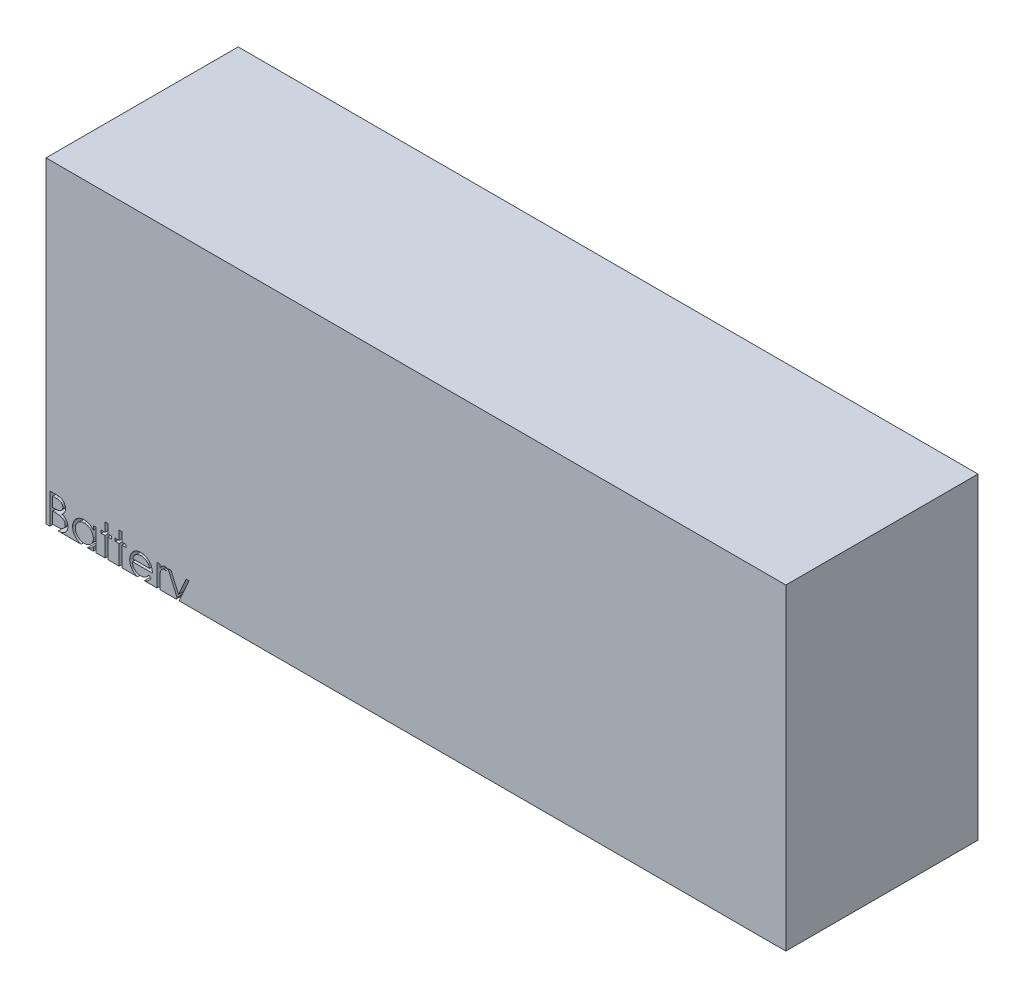
from build123d import *

# Parameters (mm, degrees)
SKETCH1_W           = 77
SKETCH1_H           = 20
BOSS_EXTRUDE1_DEPTH = 33
CUT_EXTRUDE1_DEPTH  = 1.27


with BuildPart() as part:
    # Sketch1 → Boss-Extrude1 (new body)
    with BuildSketch(Plane(origin=(0, 0, 0), x_dir=(1, 0, 0), z_dir=(0, 1, 0))):
        with Locations((38.5, 10)):
            Rectangle(SKETCH1_W, SKETCH1_H)
    extrude(amount=BOSS_EXTRUDE1_DEPTH)

    # Sketch2 → Cut-Extrude1 (cut)
    # profile 1 of 7: a face of its own
    with BuildSketch(Plane.XY):
        with BuildLine():
            Line((0.407051282, 3.175), (1.026532452, 3.175))
            add(Edge.make_bspline(
                [(1.026532452, 3.175), (1.056856857, 3.174840569), (1.115633102, 3.174531553), (1.201103595, 3.169738998), (1.281157873, 3.163204241), (1.355819153, 3.152835514), (1.425052933, 3.140324401), (1.489067861, 3.125173468), (1.547660374, 3.107006469), (1.617612642, 3.078117342), (1.697369242, 3.035188468), (1.783727784, 2.97175327), (1.857573058, 2.894163107), (1.921242074, 2.806639555), (1.971861661, 2.710359248), (2.008482381, 2.607616984), (2.031667025, 2.499737975), (2.03405139, 2.425675949), (2.03525641, 2.388246194)],
                knots=[0, 0, 0, 0, 1.001505555, 1.941167018, 2.826882275, 3.653841531, 4.429895133, 5.150066043, 5.825578002, 6.45369114, 7.647487171, 8.808567382, 9.977351308, 11.170798116, 12.373658725, 13.556498008, 14.765093433, 16, 16, 16, 16], degree=3))
            add(Edge.make_bspline(
                [(2.03525641, 2.388246194), (2.034264705, 2.353182804), (2.032315911, 2.284279937), (2.013680693, 2.183501709), (1.984506372, 2.087570246), (1.943952325, 1.996835654), (1.891245514, 1.913348019), (1.828781182, 1.836433856), (1.753418654, 1.769349683), (1.696955144, 1.731845764), (1.668274239, 1.712795473)],
                knots=[0, 0, 0, 0, 1.044552857, 2.05264487, 3.044412934, 4.028983338, 5.005914585, 5.980388656, 6.974128949, 8, 8, 8, 8], degree=3))
            add(Edge.make_bspline(
                [(1.668274239, 1.712795473), (1.704342627, 1.698947938), (1.773350388, 1.672454174), (1.868315556, 1.625613431), (1.950135165, 1.574666374), (2.019438291, 1.519029624), (2.078708878, 1.459059489), (2.130464046, 1.393876635), (2.174625007, 1.322630762), (2.212464588, 1.246064698), (2.241990959, 1.164960259), (2.264103387, 1.080078197), (2.276773858, 0.991722887), (2.278576933, 0.931592578), (2.279487179, 0.901236979)],
                knots=[0, 0, 0, 0, 1.27268992, 2.434971085, 3.483601985, 4.442670788, 5.356604649, 6.2567628, 7.179492994, 8.113709626, 9.066344395, 10.018646069, 10.999752585, 12, 12, 12, 12], degree=3))
            add(Edge.make_bspline(
                [(2.279487179, 0.901236979), (2.278601041, 0.870242745), (2.276857537, 0.809260721), (2.263994277, 0.719675707), (2.242214587, 0.634064148), (2.212214333, 0.551872304), (2.173059948, 0.473259182), (2.12540958, 0.398135721), (2.068593805, 0.327256721), (2.005036774, 0.259834577), (1.933134684, 0.199212227), (1.855559678, 0.145222979), (1.771334802, 0.100821908), (1.681843351, 0.063523803), (1.586081435, 0.035032987), (1.48447907, 0.015100724), (1.377123882, 0.00167044), (1.303455036, 0.000566261), (1.26567508, 0)],
                knots=[0, 0, 0, 0, 0.978564426, 1.925352924, 2.850884081, 3.763762016, 4.682927383, 5.618979971, 6.567305752, 7.547517671, 8.540179244, 9.531824382, 10.526200242, 11.540722885, 12.589160233, 13.674978461, 14.80764778, 16, 16, 16, 16], degree=3))
            Line((1.26567508, 0), (0.407051282, 0))
            Line((0.407051282, 0), (0.407051282, 3.175))
        make_face()
        with BuildLine():
            Line((0.691987179, 2.849358974), (0.691987179, 1.831730769))
            Line((0.691987179, 1.831730769), (0.883428486, 1.831730769))
            add(Edge.make_bspline(
                [(0.883428486, 1.831730769), (0.91141275, 1.832093557), (0.965484052, 1.832794536), (1.043788529, 1.834802512), (1.116473367, 1.840425023), (1.183413101, 1.846045917), (1.244502318, 1.855185008), (1.299605678, 1.866063576), (1.349587977, 1.877568783), (1.407227422, 1.897135389), (1.472607882, 1.926052994), (1.542306484, 1.970931017), (1.603751324, 2.024383823), (1.655637345, 2.086061339), (1.698102036, 2.153975664), (1.72759662, 2.227043192), (1.747596657, 2.303442883), (1.74940326, 2.355892298), (1.750320513, 2.382522035)],
                knots=[0, 0, 0, 0, 1.156816544, 2.235205308, 3.236616184, 4.169592532, 5.011045266, 5.787822928, 6.49130361, 7.128639758, 8.301311294, 9.436451833, 10.541879658, 11.654887649, 12.756523258, 13.837046038, 14.901820046, 16, 16, 16, 16], degree=3))
            add(Edge.make_bspline(
                [(1.750320513, 2.382522035), (1.749843192, 2.400143985), (1.748906876, 2.434711364), (1.741238523, 2.485102564), (1.72820508, 2.532495111), (1.7114644, 2.577538482), (1.688070375, 2.618824232), (1.660526376, 2.657779845), (1.627247214, 2.693078696), (1.589367366, 2.726071026), (1.545816687, 2.755321419), (1.496621158, 2.780939826), (1.441115194, 2.801568959), (1.380234247, 2.819635755), (1.313041189, 2.832325136), (1.240311416, 2.842896423), (1.161449206, 2.848278267), (1.106889006, 2.848990704), (1.078685897, 2.849358974)],
                knots=[0, 0, 0, 0, 0.91205012, 1.789085906, 2.630437955, 3.453916878, 4.269457761, 5.079663411, 5.91843418, 6.774407191, 7.675494373, 8.627863946, 9.638891023, 10.736472738, 11.911756761, 13.175263542, 14.539845004, 16, 16, 16, 16], degree=3))
            Line((1.078685897, 2.849358974), (0.691987179, 2.849358974))
        make_face(mode=Mode.SUBTRACT)
        with BuildLine():
            Line((0.691987179, 1.506089744), (0.691987179, 0.325641026))
            Line((0.691987179, 0.325641026), (1.097766426, 0.325641026))
            add(Edge.make_bspline(
                [(1.097766426, 0.325641026), (1.126812166, 0.325989139), (1.182794001, 0.326660083), (1.263621545, 0.328850429), (1.338536218, 0.333832707), (1.40719617, 0.341675728), (1.470342795, 0.350183321), (1.527218568, 0.361623555), (1.578284536, 0.374730826), (1.637497658, 0.394991111), (1.704175841, 0.426465766), (1.776031403, 0.473922243), (1.839918044, 0.530458387), (1.894169958, 0.59589143), (1.93863174, 0.667039848), (1.970976332, 0.742464559), (1.99092518, 0.820919287), (1.993340148, 0.874410519), (1.994551282, 0.901236979)],
                knots=[0, 0, 0, 0, 1.160039823, 2.235823828, 3.228722157, 4.157150951, 4.99529583, 5.772374946, 6.472645482, 7.099169577, 8.269452708, 9.405989375, 10.527446681, 11.663510218, 12.788923519, 13.866172445, 14.929861265, 16, 16, 16, 16], degree=3))
            add(Edge.make_bspline(
                [(1.994551282, 0.901236979), (1.994300816, 0.918013081), (1.993803924, 0.951294684), (1.986310366, 1.000204035), (1.97541207, 1.047580363), (1.961322841, 1.093552313), (1.940803753, 1.137288733), (1.916849244, 1.179654626), (1.88876283, 1.220705997), (1.844998479, 1.272605684), (1.781342465, 1.332401831), (1.690894175, 1.390946565), (1.588049305, 1.438161362), (1.513457222, 1.458208744), (1.47492488, 1.468564704)],
                knots=[0, 0, 0, 0, 0.723448775, 1.435228256, 2.130040452, 2.821711965, 3.505591119, 4.210454504, 4.921174351, 5.648778258, 7.137944449, 8.670945889, 10.280296675, 12, 12, 12, 12], degree=3))
            add(Edge.make_bspline(
                [(1.47492488, 1.468564704), (1.459477057, 1.471698958), (1.425982991, 1.478494669), (1.371366115, 1.485668086), (1.309012862, 1.492058961), (1.238779252, 1.496786226), (1.160576425, 1.50167259), (1.074237363, 1.503572892), (0.980114656, 1.505840078), (0.91480729, 1.506004393), (0.880884415, 1.506089744)],
                knots=[0, 0, 0, 0, 0.634451884, 1.375622551, 2.216452059, 3.157844607, 4.20941857, 5.370758133, 6.634282058, 8, 8, 8, 8], degree=3))
            Line((0.880884415, 1.506089744), (0.691987179, 1.506089744))
        make_face(mode=Mode.SUBTRACT)
    # profile 2 of 7: a face of its own
    with BuildSketch(Plane.XY):
        with BuildLine():
            Line((5.21025641, 2.320192308), (5.21025641, 0))
            Line((5.21025641, 0), (4.925320513, 0))
            Line((4.925320513, 0), (4.925320513, 0.401327123))
            add(Edge.make_bspline(
                [(4.925320513, 0.401327123), (4.89319061, 0.365005492), (4.8304887, 0.294123371), (4.725767115, 0.201520257), (4.614761696, 0.124977066), (4.498011212, 0.063155356), (4.375621091, 0.016716848), (4.247862641, -0.016290596), (4.114683745, -0.037512147), (4.023740538, -0.039631252), (3.977654247, -0.040705128)],
                knots=[0, 0, 0, 0, 1.074387032, 2.096679803, 3.090159297, 4.057316773, 5.018401886, 5.985159533, 6.978961417, 8, 8, 8, 8], degree=3))
            add(Edge.make_bspline(
                [(3.977654247, -0.040705128), (3.93668046, -0.039592633), (3.855878339, -0.037398744), (3.737016247, -0.020378655), (3.622632564, 0.006954124), (3.512619201, 0.044964216), (3.407688041, 0.095383962), (3.306940667, 0.155746379), (3.210899011, 0.227629132), (3.121026972, 0.309805415), (3.038266515, 0.399063725), (2.965639503, 0.494264328), (2.905084924, 0.594995561), (2.854448136, 0.699982065), (2.815444309, 0.810032028), (2.788253941, 0.924764887), (2.771253679, 1.044044987), (2.769060697, 1.125270126), (2.767948718, 1.16645633)],
                knots=[0, 0, 0, 0, 1.033919861, 2.038935746, 3.024066025, 3.998881131, 4.97069526, 5.957263378, 6.95902576, 7.993208707, 9.027059324, 10.027763471, 11.009749337, 11.988697705, 12.965288445, 13.950418724, 14.960734635, 16, 16, 16, 16], degree=3))
            add(Edge.make_bspline(
                [(2.767948718, 1.16645633), (2.769085342, 1.206791261), (2.771332386, 1.286531244), (2.788072093, 1.403805492), (2.816221651, 1.516761342), (2.85572577, 1.625035141), (2.9063824, 1.728757901), (2.968002879, 1.82800298), (3.040591657, 1.923043791), (3.124277769, 2.011645547), (3.214932882, 2.093488533), (3.311914373, 2.164616738), (3.412809779, 2.226045594), (3.519184081, 2.274716962), (3.629462812, 2.314095221), (3.744627723, 2.341339413), (3.864199655, 2.357393412), (3.945380316, 2.359718205), (3.986558494, 2.360897436)],
                knots=[0, 0, 0, 0, 1.020392517, 2.01726096, 2.990465484, 3.961182959, 4.928053699, 5.906110375, 6.912531644, 7.948652711, 8.985773172, 9.998621852, 10.987621588, 11.969261332, 12.953316658, 13.946091881, 14.958173133, 16, 16, 16, 16], degree=3))
            add(Edge.make_bspline(
                [(3.986558494, 2.360897436), (4.033911223, 2.35959319), (4.12676769, 2.357035625), (4.262592384, 2.335751579), (4.391084161, 2.299793827), (4.513234894, 2.250882954), (4.628605945, 2.185887321), (4.736105081, 2.103899785), (4.836857341, 2.005437423), (4.895259463, 1.929808519), (4.925320513, 1.890880409)],
                knots=[0, 0, 0, 0, 1.038897134, 2.037228247, 3.008116434, 3.962042015, 4.918381754, 5.904844433, 6.921570401, 8, 8, 8, 8], degree=3))
            Line((4.925320513, 1.890880409), (4.925320513, 2.320192308))
            Line((4.925320513, 2.320192308), (5.21025641, 2.320192308))
        make_face()
        with BuildLine():
            add(Edge.make_bspline(
                [(3.990374599, 2.075961538), (3.948723736, 2.074479596), (3.866511556, 2.071554476), (3.74582164, 2.04871852), (3.630330185, 2.010723209), (3.520614818, 1.958760342), (3.41840865, 1.893419988), (3.327065106, 1.814388447), (3.245837084, 1.723822013), (3.17752173, 1.622129384), (3.121831779, 1.513110687), (3.082673114, 1.399151376), (3.05684744, 1.28230686), (3.054208996, 1.203056424), (3.052884615, 1.163276242)],
                knots=[0, 0, 0, 0, 1.031046209, 2.035121221, 3.029706178, 4.034933723, 5.034054252, 6.02443088, 7.017295772, 8.038157696, 9.050218397, 10.03989886, 11.016116709, 12, 12, 12, 12], degree=3))
            add(Edge.make_bspline(
                [(3.052884615, 1.163276242), (3.05457634, 1.123733788), (3.057953158, 1.044803872), (3.08221986, 0.927800063), (3.122932316, 0.813813896), (3.178487616, 0.703812852), (3.24805334, 0.60168299), (3.328688046, 0.509390164), (3.421171516, 0.430024609), (3.523612897, 0.363587667), (3.633021556, 0.309918809), (3.748078051, 0.272575693), (3.866619523, 0.248465849), (3.947221283, 0.245649645), (3.987830529, 0.244230769)],
                knots=[0, 0, 0, 0, 0.979072187, 1.954306742, 2.945804271, 3.96968567, 4.997920485, 5.998718438, 6.996577872, 8.005894225, 9.015743152, 10.005417472, 10.995077863, 12, 12, 12, 12], degree=3))
            add(Edge.make_bspline(
                [(3.987830529, 0.244230769), (4.029056999, 0.245736594), (4.11105236, 0.248731529), (4.232100331, 0.271665248), (4.349570761, 0.309555515), (4.461863461, 0.362078295), (4.566471666, 0.427172467), (4.660359026, 0.5033789), (4.739748512, 0.592009646), (4.807051808, 0.689415428), (4.859825221, 0.796197025), (4.898266361, 0.909893041), (4.920993832, 1.030507434), (4.923858344, 1.112933996), (4.925320513, 1.155008013)],
                knots=[0, 0, 0, 0, 1.01762866, 2.023962475, 3.030623092, 4.058876274, 5.077231937, 6.066672613, 7.034107872, 8.005628644, 8.981990164, 9.965428785, 10.961468474, 12, 12, 12, 12], degree=3))
            add(Edge.make_bspline(
                [(4.925320513, 1.155008013), (4.924449967, 1.187064473), (4.922736459, 1.250161732), (4.90964587, 1.34280598), (4.888822473, 1.431464432), (4.859479876, 1.5162303), (4.820934211, 1.596634921), (4.774445166, 1.673255618), (4.719195222, 1.745693888), (4.656073776, 1.812952245), (4.586981057, 1.874299107), (4.513870295, 1.929058097), (4.435875289, 1.974042198), (4.354307691, 2.011272494), (4.269025981, 2.040899009), (4.179336204, 2.06066356), (4.086191695, 2.074234708), (4.022649916, 2.075379868), (3.990374599, 2.075961538)],
                knots=[0, 0, 0, 0, 1.050140795, 2.067009409, 3.05949893, 4.030605086, 5.00011959, 5.97591094, 6.962425594, 7.979863591, 8.993523472, 9.986985069, 10.967611495, 11.937549037, 12.921786183, 13.919465291, 14.943216303, 16, 16, 16, 16], degree=3))
        make_face(mode=Mode.SUBTRACT)
    # profile 3 of 7: a face of its own
    with BuildSketch(Plane.XY):
        Polygon((6.146474359, 3.256410256), (6.431410256, 3.256410256), (6.431410256, 2.320192308), (6.838461538, 2.320192308), (6.838461538, 2.03525641), (6.431410256, 2.03525641), (6.431410256, 0), (6.146474359, 0), (6.146474359, 2.03525641), (5.739423077, 2.03525641), (5.739423077, 2.320192308), (6.146474359, 2.320192308), align=None)
    # profile 4 of 7: a face of its own
    with BuildSketch(Plane.XY):
        Polygon((7.611858974, 3.256410256), (7.896794872, 3.256410256), (7.896794872, 2.320192308), (8.303846154, 2.320192308), (8.303846154, 2.03525641), (7.896794872, 2.03525641), (7.896794872, 0), (7.611858974, 0), (7.611858974, 2.03525641), (7.204807692, 2.03525641), (7.204807692, 2.320192308), (7.611858974, 2.320192308), align=None)
    # profile 5 of 7: a face of its own
    with BuildSketch(Plane.XY):
        with BuildLine():
            Line((10.696544471, 0.732692308), (10.949679487, 0.599764623))
            add(Edge.make_bspline(
                [(10.949679487, 0.599764623), (10.929507719, 0.563983887), (10.890261445, 0.494368744), (10.822769338, 0.398726985), (10.752019387, 0.312686557), (10.67481793, 0.238546085), (10.593474721, 0.1739109), (10.50753867, 0.117361587), (10.416562385, 0.069175501), (10.320541564, 0.028578565), (10.218669828, -0.002635762), (10.11070031, -0.024683162), (9.996426167, -0.038311413), (9.918097847, -0.039894505), (9.877989784, -0.040705128)],
                knots=[0, 0, 0, 0, 1.120438281, 2.179929193, 3.190490725, 4.156257408, 5.095198341, 6.022838206, 6.959905092, 7.901321166, 8.864066838, 9.862729781, 10.905609505, 12, 12, 12, 12], degree=3))
            add(Edge.make_bspline(
                [(9.877989784, -0.040705128), (9.83341099, -0.039664476), (9.746450677, -0.037634466), (9.619868193, -0.020133445), (9.500688292, 0.008416481), (9.388917675, 0.048299508), (9.28483006, 0.100394295), (9.18821857, 0.163857539), (9.098575143, 0.238363227), (9.018724611, 0.324556715), (8.946839089, 0.416796776), (8.88340638, 0.5129139), (8.830377139, 0.612666254), (8.787240129, 0.7154188), (8.75240143, 0.820523904), (8.728120206, 0.928937878), (8.71412322, 1.040367301), (8.71197833, 1.115748455), (8.710897436, 1.153735978)],
                knots=[0, 0, 0, 0, 1.145258523, 2.234067595, 3.276747158, 4.290159414, 5.277019952, 6.260822364, 7.254936242, 8.264827045, 9.274100331, 10.257902744, 11.220704747, 12.172965371, 13.118907548, 14.062713208, 15.023725156, 16, 16, 16, 16], degree=3))
            add(Edge.make_bspline(
                [(8.710897436, 1.153735978), (8.711858228, 1.189382002), (8.713762392, 1.260027716), (8.725764607, 1.364590031), (8.747035558, 1.466215842), (8.776224081, 1.564989591), (8.813916997, 1.660745898), (8.860029081, 1.753543042), (8.914632167, 1.843282276), (8.956789521, 1.899890833), (8.97802484, 1.928405449)],
                knots=[0, 0, 0, 0, 1.024358464, 2.0301432, 3.019427413, 4.004406732, 4.986367066, 5.972626655, 6.978780325, 8, 8, 8, 8], degree=3))
            add(Edge.make_bspline(
                [(8.97802484, 1.928405449), (9.006788238, 1.962757924), (9.063403882, 2.030374674), (9.159158576, 2.119218727), (9.262845183, 2.193644152), (9.373164301, 2.25533634), (9.491398102, 2.302211719), (9.615957245, 2.337143598), (9.748260026, 2.356717936), (9.838706905, 2.359482757), (9.884985978, 2.360897436)],
                knots=[0, 0, 0, 0, 1.030682036, 2.02871468, 2.997146059, 3.962720338, 4.930598197, 5.918074684, 6.934738563, 8, 8, 8, 8], degree=3))
            add(Edge.make_bspline(
                [(9.884985978, 2.360897436), (9.932563448, 2.35966912), (10.0258996, 2.357259445), (10.162000167, 2.334919842), (10.290778817, 2.299493596), (10.412184017, 2.249461229), (10.526228076, 2.18490935), (10.632169707, 2.104952108), (10.731820722, 2.012044272), (10.789794933, 1.940594789), (10.819295873, 1.904236779)],
                knots=[0, 0, 0, 0, 1.056321875, 2.072262726, 3.055038591, 4.01806755, 4.982017516, 5.957941055, 6.960871419, 8, 8, 8, 8], degree=3))
            add(Edge.make_bspline(
                [(10.819295873, 1.904236779), (10.839368167, 1.876837816), (10.879379148, 1.822222265), (10.92949616, 1.733167001), (10.973000369, 1.639993819), (11.007773841, 1.541196621), (11.035931102, 1.437946002), (11.056302645, 1.329503836), (11.068249371, 1.215902417), (11.070597689, 1.138499042), (11.071794872, 1.099038462)],
                knots=[0, 0, 0, 0, 0.94817472, 1.890038105, 2.849395472, 3.817997239, 4.812318967, 5.836947057, 6.897266129, 8, 8, 8, 8], degree=3))
            Line((11.071794872, 1.099038462), (8.995833333, 1.099038462))
            add(Edge.make_bspline(
                [(8.995833333, 1.099038462), (8.997229976, 1.068467326), (8.999976418, 1.008350421), (9.01278087, 0.920384068), (9.032963686, 0.836588251), (9.061329193, 0.757591491), (9.095679831, 0.682362018), (9.137758303, 0.611457885), (9.187959184, 0.545202048), (9.243953211, 0.483001859), (9.306280362, 0.427611026), (9.37185114, 0.378034057), (9.441604588, 0.336481837), (9.514990706, 0.302754366), (9.591890826, 0.276350779), (9.672329174, 0.258327828), (9.756147465, 0.246256381), (9.813284524, 0.244914113), (9.842372796, 0.244230769)],
                knots=[0, 0, 0, 0, 1.094153842, 2.151609401, 3.174256925, 4.172055639, 5.149267565, 6.128595816, 7.11444997, 8.118368179, 9.117203808, 10.09244225, 11.054858984, 12.015122123, 12.976791628, 13.957293641, 14.960065497, 16, 16, 16, 16], degree=3))
            add(Edge.make_bspline(
                [(9.842372796, 0.244230769), (9.870812766, 0.244782363), (9.927243121, 0.245876832), (10.011281613, 0.256519351), (10.093958185, 0.273728102), (10.174930648, 0.297214021), (10.25255563, 0.325858737), (10.324442664, 0.360423472), (10.390555432, 0.398659314), (10.452347251, 0.442392376), (10.512283081, 0.495921231), (10.571739479, 0.56271935), (10.635490443, 0.641720179), (10.675395288, 0.701179461), (10.696544471, 0.732692308)],
                knots=[0, 0, 0, 0, 0.99110716, 1.966546729, 2.947904876, 3.932708344, 4.903319531, 5.828989031, 6.710028674, 7.56322171, 8.463672341, 9.504779593, 10.677557249, 12, 12, 12, 12], degree=3))
        make_face()
        with BuildLine():
            add(Edge.make_bspline(
                [(10.786858974, 1.383974359), (10.776429894, 1.421768537), (10.75635727, 1.494510165), (10.714414282, 1.595240115), (10.667177956, 1.68476414), (10.611278243, 1.762397092), (10.547942684, 1.831343136), (10.474785983, 1.891594282), (10.392747708, 1.945494398), (10.302251916, 1.990989879), (10.206419726, 2.02971568), (10.106084109, 2.055682749), (10.003705972, 2.073471405), (9.93445987, 2.075127947), (9.899614383, 2.075961538)],
                knots=[0, 0, 0, 0, 1.154881502, 2.222775134, 3.210006277, 4.132804581, 5.035138423, 5.962687519, 6.919655026, 7.923214229, 8.944639381, 9.960483929, 10.97369054, 12, 12, 12, 12], degree=3))
            add(Edge.make_bspline(
                [(9.899614383, 2.075961538), (9.871175964, 2.075406665), (9.814959188, 2.074309797), (9.732136076, 2.063904751), (9.652598063, 2.046705463), (9.575758267, 2.023151538), (9.502623622, 1.991756592), (9.431689796, 1.954941807), (9.364760437, 1.910000514), (9.32290369, 1.875747838), (9.301757812, 1.85844351)],
                knots=[0, 0, 0, 0, 1.04873581, 2.073130211, 3.073294108, 4.04793562, 5.032784715, 6.005352987, 6.992311501, 8, 8, 8, 8], degree=3))
            add(Edge.make_bspline(
                [(9.301757812, 1.85844351), (9.286614621, 1.844750809), (9.255968492, 1.81704012), (9.21501959, 1.769297911), (9.175812447, 1.717816137), (9.140131205, 1.660625203), (9.10740368, 1.598376353), (9.076778558, 1.531594641), (9.049213742, 1.459773302), (9.033705127, 1.409724017), (9.025726162, 1.383974359)],
                knots=[0, 0, 0, 0, 0.879870761, 1.780643979, 2.707998968, 3.669668524, 4.684282772, 5.740141944, 6.837334558, 8, 8, 8, 8], degree=3))
            Line((9.025726162, 1.383974359), (10.786858974, 1.383974359))
        make_face(mode=Mode.SUBTRACT)
    # profile 6 of 7: a face of its own
    with BuildSketch(Plane.XY):
        with BuildLine():
            Line((11.56025641, 2.320192308), (11.845192308, 2.320192308))
            Line((11.845192308, 2.320192308), (11.845192308, 1.978650841))
            add(Edge.make_bspline(
                [(11.845192308, 1.978650841), (11.866227825, 2.010451486), (11.906458087, 2.071269971), (11.973326244, 2.151705694), (12.041818552, 2.218303629), (12.112262901, 2.271374678), (12.18517732, 2.311119436), (12.258961555, 2.340232403), (12.334776445, 2.357447539), (12.385723334, 2.35974593), (12.411247997, 2.360897436)],
                knots=[0, 0, 0, 0, 1.2804753, 2.448899062, 3.506932113, 4.484331642, 5.4025378, 6.288909075, 7.142734305, 8, 8, 8, 8], degree=3))
            add(Edge.make_bspline(
                [(12.411247997, 2.360897436), (12.431047593, 2.359817458), (12.471786549, 2.357595334), (12.53345647, 2.341982657), (12.596995887, 2.317056165), (12.637946481, 2.293615392), (12.659294872, 2.281395232)],
                knots=[0, 0, 0, 0, 0.901110191, 1.854092781, 2.881294221, 4, 4, 4, 4], degree=3))
            Line((12.659294872, 2.281395232), (12.502834535, 2.034620393))
            add(Edge.make_bspline(
                [(12.502834535, 2.034620393), (12.489128495, 2.040734777), (12.463111806, 2.052341049), (12.425053021, 2.066077015), (12.389963522, 2.074165024), (12.367608294, 2.075390318), (12.357186498, 2.075961538)],
                knots=[0, 0, 0, 0, 1.180555205, 2.24091978, 3.179933427, 4, 4, 4, 4], degree=3))
            add(Edge.make_bspline(
                [(12.357186498, 2.075961538), (12.334321297, 2.074437505), (12.287682915, 2.071328917), (12.21920769, 2.04689157), (12.152762011, 2.007407959), (12.099992003, 1.963619165), (12.059132245, 1.921393663), (12.029976469, 1.884519755), (12.003231406, 1.843173425), (11.977676992, 1.798061498), (11.954393996, 1.748413709), (11.932663689, 1.694726079), (11.913016006, 1.636936427), (11.901812571, 1.596675141), (11.896073718, 1.576051683)],
                knots=[0, 0, 0, 0, 1.125678352, 2.296057538, 3.5422874, 4.923748041, 5.663163013, 6.437101912, 7.23742474, 8.08941207, 8.991984279, 9.93940061, 10.944477711, 12, 12, 12, 12], degree=3))
            add(Edge.make_bspline(
                [(11.896073718, 1.576051683), (11.891780761, 1.55765739), (11.882272188, 1.516915428), (11.873027007, 1.448563552), (11.863892516, 1.367806376), (11.857454869, 1.274419109), (11.851487645, 1.168634964), (11.848122071, 1.050292785), (11.845307079, 0.919271102), (11.845231725, 0.827672938), (11.845192308, 0.779757612)],
                knots=[0, 0, 0, 0, 0.566838948, 1.255505196, 2.06880316, 3.007127437, 4.065329342, 5.249902469, 6.561414163, 8, 8, 8, 8], degree=3))
            Line((11.845192308, 0.779757612), (11.845192308, 0))
            Line((11.845192308, 0), (11.56025641, 0))
            Line((11.56025641, 0), (11.56025641, 2.320192308))
        make_face()
    # profile 7 of 7: a face of its own
    with BuildSketch(Plane.XY):
        Polygon((12.7, 2.320192308), (13.007196514, 2.320192308), (13.792678285, 0.543159054), (14.590244391, 2.320192308), (14.898076923, 2.320192308), (13.473397436, -0.854807692), (13.165564904, -0.854807692), (13.638126002, 0.197801482), align=None)
    extrude(amount=-CUT_EXTRUDE1_DEPTH, mode=Mode.SUBTRACT)


solid = part.part
